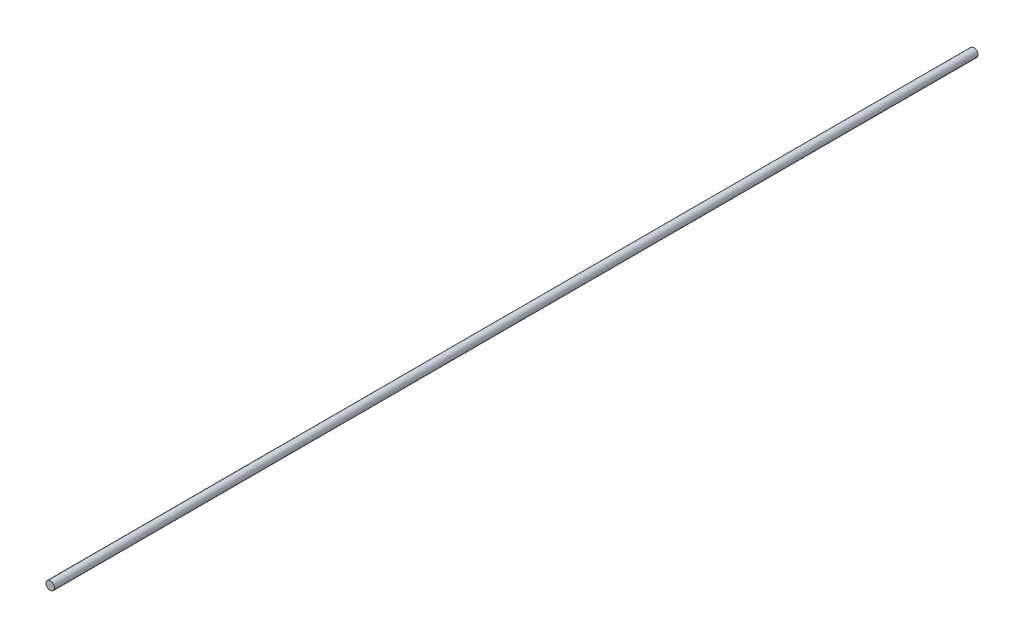
from build123d import *

# Parameters (mm, degrees)
SKETCH1_R           = 1
BOSS_EXTRUDE1_DEPTH = 220


with BuildPart() as part:
    # Sketch1 → Boss-Extrude1 (new body)
    with BuildSketch(Plane.XY):
        Circle(SKETCH1_R)
    extrude(amount=BOSS_EXTRUDE1_DEPTH)


solid = part.part
